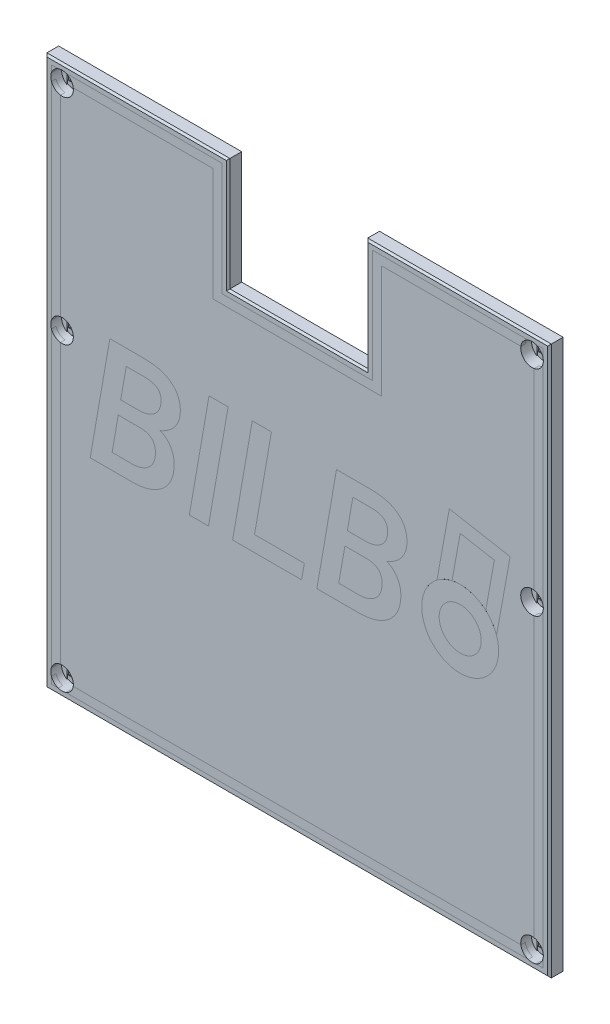
from build123d import *
from build123d.topology import SkipClean

# Parameters (mm, degrees)
SKETCH1_R             = 1.35
BOSS_EXTRUDE1_DEPTH   = 3
SKETCH3_R             = 2.5
CUT_EXTRUDE1_DEPTH    = 2.4
SKETCH4_W             = 91.5
SKETCH4_H             = 85.5
CUT_EXTRUDE2_DEPTH    = 1.5
CUT_EXTRUDE3_DEPTH    = 0.2
SKETCH6_W             = 2.7
SKETCH6_H             = 2.7
CUT_EXTRUDE4_DEPTH    = 0.2
CHAMFER1_SIZE         = 0.4
CUT_EXTRUDE5_DEPTH    = 1
BOSS_EXTRUDE2_DEPTH   = 1
SKETCH9_R             = 2.5
CUT_EXTRUDE6_DEPTH    = 2.4
CUT_EXTRUDE8_DEPTH    = 1
BOSS_EXTRUDE4_DEPTH   = 1
BOSS_EXTRUDE4_2_DEPTH = 1
BOSS_EXTRUDE4_3_DEPTH = 1
BOSS_EXTRUDE4_4_DEPTH = 1
BOSS_EXTRUDE4_5_DEPTH = 1
CUT_EXTRUDE9_DEPTH    = 1
BOSS_EXTRUDE5_DEPTH   = 1


with BuildPart() as part:
    # Sketch1 → Boss-Extrude1 (new body)
    with BuildSketch(Plane.XY):
        Polygon((-15.25, 53.75), (-15.25, 28.75), (15.25, 28.75), (15.25, 53.75), (55.875, 53.75), (55.875, -67.75), (-55.75, -67.75), (-55.75, 53.75), align=None)
        with Locations((-52, 50)):
            Circle(SKETCH1_R, mode=Mode.SUBTRACT)
        with Locations((-52, 2.6)):
            Circle(SKETCH1_R, mode=Mode.SUBTRACT)
        with Locations((-52, -64)):
            Circle(SKETCH1_R, mode=Mode.SUBTRACT)
        with Locations((52, 50)):
            Circle(SKETCH1_R, mode=Mode.SUBTRACT)
        with Locations((52, 2.6)):
            Circle(SKETCH1_R, mode=Mode.SUBTRACT)
        with Locations((52, -64)):
            Circle(SKETCH1_R, mode=Mode.SUBTRACT)
    extrude(amount=BOSS_EXTRUDE1_DEPTH)

    # Sketch3 → Cut-Extrude1 (cut)
    with BuildSketch(Plane.XY.offset(3)):
        with Locations((-52, 50)):
            Circle(SKETCH3_R)
        with Locations((-52, 2.6)):
            Circle(SKETCH3_R)
        with Locations((-52, -64)):
            Circle(SKETCH3_R)
        with Locations((52, -64)):
            Circle(SKETCH3_R)
        with Locations((52, 2.6)):
            Circle(SKETCH3_R)
        with Locations((52, 50)):
            Circle(SKETCH3_R)
    extrude(amount=-CUT_EXTRUDE1_DEPTH, mode=Mode.SUBTRACT)

    # Sketch4 → Cut-Extrude2 (cut)
    with BuildSketch(Plane(origin=(0, 0, 0), x_dir=(-1, 0, 0), z_dir=(0, 0, -1))):
        with Locations((0, -15)):
            Rectangle(SKETCH4_W, SKETCH4_H)
    extrude(amount=-CUT_EXTRUDE2_DEPTH, mode=Mode.SUBTRACT)

    # Sketch5 → Cut-Extrude3 (cut)
    with SkipClean():  # the faces are left unmerged after this step: merging them gives an invalid solid
        with BuildSketch(Plane.XY.offset(0.6)):
            with BuildLine():
                Line((-53.35, 47.895837459), (-53.35, 52.104162541))
                ThreePointArc((-53.35, 52.104162541), (-52, 52.5), (-50.65, 52.104162541))
                Line((-50.65, 52.104162541), (-50.65, 47.895837459))
                ThreePointArc((-50.65, 47.895837459), (-52, 47.5), (-53.35, 47.895837459))
            make_face()
            with BuildLine():
                Line((-53.35, 0.495837459), (-53.35, 4.704162541))
                ThreePointArc((-53.35, 4.704162541), (-52, 5.1), (-50.65, 4.704162541))
                Line((-50.65, 4.704162541), (-50.65, 0.495837459))
                ThreePointArc((-50.65, 0.495837459), (-52, 0.1), (-53.35, 0.495837459))
            make_face()
            with BuildLine():
                Line((-53.35, -66.104162541), (-53.35, -61.895837459))
                ThreePointArc((-53.35, -61.895837459), (-52, -61.5), (-50.65, -61.895837459))
                Line((-50.65, -61.895837459), (-50.65, -66.104162541))
                ThreePointArc((-50.65, -66.104162541), (-52, -66.5), (-53.35, -66.104162541))
            make_face()
        cut_extrude3 = extrude(amount=-CUT_EXTRUDE3_DEPTH, mode=Mode.SUBTRACT)

    # Sketch6 → Cut-Extrude4 (cut)
    with SkipClean():  # the faces are left unmerged after this step: merging them gives an invalid solid
        with BuildSketch(Plane.XY.offset(0.4)):
            with Locations((-52, -64)):
                Rectangle(SKETCH6_W, SKETCH6_H)
            with Locations((-52, 2.6)):
                Rectangle(SKETCH6_W, SKETCH6_H)
            with Locations((-52, 50)):
                Rectangle(SKETCH6_W, SKETCH6_H)
        cut_extrude4 = extrude(amount=-CUT_EXTRUDE4_DEPTH, mode=Mode.SUBTRACT)

    # Mirror1: Cut-Extrude3, Cut-Extrude4 across plane
    with SkipClean():  # the faces are left unmerged after this step: merging them gives an invalid solid
        add(cut_extrude3.mirror(Plane(origin=(0, 0, 0), x_dir=(0, 0, 1), z_dir=(1, 0, 0))), mode=Mode.SUBTRACT)
        add(cut_extrude4.mirror(Plane(origin=(0, 0, 0), x_dir=(0, 0, 1), z_dir=(1, 0, 0))), mode=Mode.SUBTRACT)

    # Chamfer1
    chamfer1_edges = [part.edges().sort_by_distance(p)[0] for p in [
        (55.875, -7, 3),
        (35.5625, 53.75, 3),
        (15.25, 41.25, 3),
        (0, 28.75, 3),
        (-15.25, 41.25, 3),
        (-35.5, 53.75, 3),
        (-55.75, -7, 3),
        (0.0625, -67.75, 3),
    ]]
    chamfer(chamfer1_edges, length=CHAMFER1_SIZE)

    # Sketch8 → Cut-Extrude5 (cut)
    with SkipClean():  # the faces are left unmerged after this step: merging them gives an invalid solid
        with BuildSketch(Plane.XY.offset(3)):
            Polygon((-54.35, 52.35), (-54.35, -66.35), (54.475, -66.35), (54.475, 52.35), (16.65, 52.35), (16.65, 27.35), (-16.65, 27.35), (-16.65, 52.35), align=None)
            Polygon((-52.35, 50.35), (-52.35, -64.35), (52.475, -64.35), (52.475, 50.35), (18.65, 50.35), (18.65, 25.35), (-18.65, 25.35), (-18.65, 50.35), align=None, mode=Mode.SUBTRACT)
        extrude(amount=-CUT_EXTRUDE5_DEPTH, mode=Mode.SUBTRACT)

    # Sketch12 → Cut-Extrude8 (cut)
    # profile 1 of 5: a face of its own
    with SkipClean():  # the faces are left unmerged after this step: merging them gives an invalid solid
        with BuildSketch(Plane.XY.offset(3)):
            with BuildLine():
                add(Edge.make_bspline(
                    [(44.615380572, -10.515732618), (44.615380572, -8.259142089), (43.71895185, -6.094974003), (42.123302186, -4.499322954)],
                    knots=[0, 0, 0, 0, 1, 1, 1, 1], degree=3))
                add(Edge.make_bspline(
                    [(42.123302186, -4.499322954), (40.527651137, -2.903673291), (38.363483052, -2.007244569), (36.106892522, -2.007244569)],
                    knots=[0, 0, 0, 0, 1, 1, 1, 1], degree=3))
                add(Edge.make_bspline(
                    [(36.106892522, -2.007244569), (32.665530039, -2.007244569), (29.563027687, -4.080271661), (28.246075041, -7.259674962)],
                    knots=[0, 0, 0, 0, 1, 1, 1, 1], degree=3))
                add(Edge.make_bspline(
                    [(28.246075041, -7.259674962), (26.929122395, -10.439079648), (27.657072789, -14.098730829), (30.090482858, -16.532142283)],
                    knots=[0, 0, 0, 0, 1, 1, 1, 1], degree=3))
                add(Edge.make_bspline(
                    [(30.090482858, -16.532142283), (32.523894312, -18.965552351), (36.183545492, -19.693502745), (39.362950179, -18.376550099)],
                    knots=[0, 0, 0, 0, 1, 1, 1, 1], degree=3))
                add(Edge.make_bspline(
                    [(39.362950179, -18.376550099), (42.542353479, -17.059597454), (44.615380572, -13.957095102), (44.615380572, -10.515732618)],
                    knots=[0, 0, 0, 0, 1, 1, 1, 1], degree=3))
            make_face()
            with BuildLine():
                add(Edge.make_bspline(
                    [(39.400110889, -7.222514251), (38.526694267, -6.349099014), (37.342088556, -5.858419426), (36.106892522, -5.858419426)],
                    knots=[0, 0, 0, 0, 1, 1, 1, 1], degree=3))
                add(Edge.make_bspline(
                    [(36.106892522, -5.858419426), (34.223185009, -5.858419426), (32.524959648, -6.993137187), (31.804095335, -8.733456501)],
                    knots=[0, 0, 0, 0, 1, 1, 1, 1], degree=3))
                add(Edge.make_bspline(
                    [(31.804095335, -8.733456501), (31.083232408, -10.47377443), (31.481691813, -12.476968645), (32.813674154, -13.808950986)],
                    knots=[0, 0, 0, 0, 1, 1, 1, 1], degree=3))
                add(Edge.make_bspline(
                    [(32.813674154, -13.808950986), (34.145656495, -15.140933327), (36.14885071, -15.539392733), (37.889168639, -14.818529805)],
                    knots=[0, 0, 0, 0, 1, 1, 1, 1], degree=3))
                add(Edge.make_bspline(
                    [(37.889168639, -14.818529805), (39.629487953, -14.097665492), (40.764205715, -12.399440131), (40.764205715, -10.515732618)],
                    knots=[0, 0, 0, 0, 1, 1, 1, 1], degree=3))
                add(Edge.make_bspline(
                    [(40.764205715, -10.515732618), (40.764205715, -9.280536584), (40.273526126, -8.095930873), (39.400110889, -7.222514251)],
                    knots=[0, 0, 0, 0, 1, 1, 1, 1], degree=3))
            make_face(mode=Mode.SUBTRACT)
        # profile 2 of 5: a face of its own
        with BuildSketch(Plane.XY.offset(3)):
            with BuildLine():
                add(Edge.make_bspline(
                    [(20.193882116, -16.683778873), (18.521539307, -18.012498708), (16.310838597, -18.676858625), (13.561781374, -18.676858625)],
                    knots=[0, 0, 0, 0, 1, 1, 1, 1], degree=3))
                Line((13.561781374, -18.676858625), (4.386795807, -18.676861396))
                Line((4.386795807, -18.676861396), (8.73374281, 6.339588017))
                Line((8.73374281, 6.339588017), (16.413932417, 6.322409639))
                add(Edge.make_bspline(
                    [(16.413932417, 6.322409639), (19.117171858, 6.310956925), (21.14460421, 5.721055579), (22.496228087, 4.55270283)],
                    knots=[0, 0, 0, 0, 1, 1, 1, 1], degree=3))
                add(Edge.make_bspline(
                    [(22.496228087, 4.55270283), (23.859294981, 3.395806951), (24.46064904, 1.786458916), (24.300290267, -0.275338504)],
                    knots=[0, 0, 0, 0, 1, 1, 1, 1], degree=3))
                add(Edge.make_bspline(
                    [(24.300290267, -0.275338504), (24.094112326, -2.703668483), (22.610764923, -4.530644402), (19.850245288, -5.756266261)],
                    knots=[0, 0, 0, 0, 1, 1, 1, 1], degree=3))
                add(Edge.make_bspline(
                    [(19.850245288, -5.756266261), (20.881151617, -6.122812673), (21.677235061, -6.792898255), (22.238497003, -7.766524391)],
                    knots=[0, 0, 0, 0, 1, 1, 1, 1], degree=3))
                add(Edge.make_bspline(
                    [(22.238497003, -7.766524391), (22.799768642, -8.740150527), (23.040311651, -9.902770685), (22.960127416, -11.25438625)],
                    knots=[0, 0, 0, 0, 1, 1, 1, 1], degree=3))
                add(Edge.make_bspline(
                    [(22.960127416, -11.25438625), (22.799768642, -13.545271195), (21.877685952, -15.355068736), (20.193882116, -16.683778873)],
                    knots=[0, 0, 0, 0, 1, 1, 1, 1], degree=3))
            make_face()
            with BuildLine():
                add(Edge.make_bspline(
                    [(20.022070629, -0.515880128), (20.308432806, 1.626095987), (19.225987186, 2.737175469), (16.77473377, 2.817355548)],
                    knots=[0, 0, 0, 0, 1, 1, 1, 1], degree=3))
                Line((16.77473377, 2.817355548), (12.359059401, 2.834533927))
                Line((12.359059401, 2.834533927), (11.139172903, -4.192745706))
                Line((11.139172903, -4.192745706), (15.039398956, -4.209924084))
                add(Edge.make_bspline(
                    [(15.039398956, -4.209924084), (16.436832303, -4.209924084), (17.576544262, -3.877748281), (18.458533449, -3.213398061)],
                    knots=[0, 0, 0, 0, 1, 1, 1, 1], degree=3))
                add(Edge.make_bspline(
                    [(18.458533449, -3.213398061), (19.340532334, -2.549038144), (19.861711855, -1.649865038), (20.022070629, -0.515880128)],
                    knots=[0, 0, 0, 0, 1, 1, 1, 1], degree=3))
            make_face(mode=Mode.SUBTRACT)
            with BuildLine():
                add(Edge.make_bspline(
                    [(18.235172974, -8.47095149), (17.719728814, -7.80660127), (16.866374875, -7.451515884), (15.675109772, -7.405698102)],
                    knots=[0, 0, 0, 0, 1, 1, 1, 1], degree=3))
                Line((15.675109772, -7.405698102), (10.589353977, -7.388533577))
                Line((10.589353977, -7.388533577), (9.232012748, -15.206164062))
                Line((9.232012748, -15.206164062), (13.682043873, -15.22334244))
                add(Edge.make_bspline(
                    [(13.682043873, -15.22334244), (15.022216422, -15.22334244), (16.161932538, -14.868252897), (17.10119222, -14.158075198)],
                    knots=[0, 0, 0, 0, 1, 1, 1, 1], degree=3))
                add(Edge.make_bspline(
                    [(17.10119222, -14.158075198), (18.040451903, -13.447905811), (18.595992337, -12.474279674), (18.767813522, -11.237196789)],
                    knots=[0, 0, 0, 0, 1, 1, 1, 1], degree=3))
                add(Edge.make_bspline(
                    [(18.767813522, -11.237196789), (18.928172295, -10.057392712), (18.750625446, -9.135311407), (18.235172974, -8.47095149)],
                    knots=[0, 0, 0, 0, 1, 1, 1, 1], degree=3))
            make_face(mode=Mode.SUBTRACT)
        # profile 3 of 5: a face of its own
        with BuildSketch(Plane.XY.offset(3)):
            Polygon((-5.664467136, 6.339588017), (-9.41006008, -15.206164062), (1.620550507, -15.206164062), (1.002004216, -18.676861396), (-14.255277022, -18.676861396), (-9.908330018, 6.339588017), align=None)
        # profile 4 of 5: a face of its own
        with BuildSketch(Plane.XY.offset(3)):
            Polygon((-15.251809971, 6.339588017), (-19.59876113, -18.676861396), (-23.825440093, -18.676861396), (-19.478488933, 6.339588017), align=None)
        # profile 5 of 5: a face of its own
        with BuildSketch(Plane.XY.offset(3)):
            with BuildLine():
                add(Edge.make_bspline(
                    [(-29.959280595, -16.683778873), (-31.63162479, -18.012498708), (-33.842326885, -18.676858625), (-36.591386879, -18.676858625)],
                    knots=[0, 0, 0, 0, 1, 1, 1, 1], degree=3))
                Line((-36.591386879, -18.676858625), (-45.766375217, -18.676861396))
                Line((-45.766375217, -18.676861396), (-41.419424057, 6.339588017))
                Line((-41.419424057, 6.339588017), (-33.739237221, 6.322409639))
                add(Edge.make_bspline(
                    [(-33.739237221, 6.322409639), (-31.035995009, 6.310956925), (-29.008564042, 5.721055579), (-27.656942936, 4.55270283)],
                    knots=[0, 0, 0, 0, 1, 1, 1, 1], degree=3))
                add(Edge.make_bspline(
                    [(-27.656942936, 4.55270283), (-26.293867731, 3.395806951), (-25.6925109, 1.786458916), (-25.852872445, -0.275338504)],
                    knots=[0, 0, 0, 0, 1, 1, 1, 1], degree=3))
                add(Edge.make_bspline(
                    [(-25.852872445, -0.275338504), (-26.059051771, -2.703668483), (-27.542399174, -4.530644402), (-30.302913267, -5.756266261)],
                    knots=[0, 0, 0, 0, 1, 1, 1, 1], degree=3))
                add(Edge.make_bspline(
                    [(-30.302913267, -5.756266261), (-29.27201525, -6.122812673), (-28.475933192, -6.792898255), (-27.914667094, -7.766524391)],
                    knots=[0, 0, 0, 0, 1, 1, 1, 1], degree=3))
                add(Edge.make_bspline(
                    [(-27.914667094, -7.766524391), (-27.353400996, -8.740150527), (-27.112857987, -9.902770685), (-27.193039452, -11.25438625)],
                    knots=[0, 0, 0, 0, 1, 1, 1, 1], degree=3))
                add(Edge.make_bspline(
                    [(-27.193039452, -11.25438625), (-27.353400996, -13.545271195), (-28.275480915, -15.355068736), (-29.959280595, -16.683778873)],
                    knots=[0, 0, 0, 0, 1, 1, 1, 1], degree=3))
            make_face()
            with BuildLine():
                add(Edge.make_bspline(
                    [(-30.131096238, -0.515880128), (-29.844736832, 1.626095987), (-30.927178296, 2.737175469), (-33.3784234, 2.817355548)],
                    knots=[0, 0, 0, 0, 1, 1, 1, 1], degree=3))
                Line((-33.3784234, 2.817355548), (-37.794101925, 2.834533927))
                Line((-37.794101925, 2.834533927), (-39.013996735, -4.192745706))
                Line((-39.013996735, -4.192745706), (-35.113767911, -4.209924084))
                add(Edge.make_bspline(
                    [(-35.113767911, -4.209924084), (-33.716329023, -4.209924084), (-32.576614293, -3.877748281), (-31.694625106, -3.213398061)],
                    knots=[0, 0, 0, 0, 1, 1, 1, 1], degree=3))
                add(Edge.make_bspline(
                    [(-31.694625106, -3.213398061), (-30.812634534, -2.549038144), (-30.291457783, -1.649865038), (-30.131096238, -0.515880128)],
                    knots=[0, 0, 0, 0, 1, 1, 1, 1], degree=3))
            make_face(mode=Mode.SUBTRACT)
            with BuildLine():
                add(Edge.make_bspline(
                    [(-31.917985581, -8.47095149), (-32.433435283, -7.80660127), (-33.286789221, -7.451515884), (-34.478047398, -7.405698102)],
                    knots=[0, 0, 0, 0, 1, 1, 1, 1], degree=3))
                Line((-34.478047398, -7.405698102), (-39.563808734, -7.388533577))
                Line((-39.563808734, -7.388533577), (-40.92115689, -15.206164062))
                Line((-40.92115689, -15.206164062), (-36.471116067, -15.22334244))
                add(Edge.make_bspline(
                    [(-36.471116067, -15.22334244), (-35.13094906, -15.22334244), (-33.991235715, -14.868252897), (-33.051973262, -14.158075198)],
                    knots=[0, 0, 0, 0, 1, 1, 1, 1], degree=3))
                add(Edge.make_bspline(
                    [(-33.051973262, -14.158075198), (-32.112710808, -13.447905811), (-31.55717176, -12.474279674), (-31.385354731, -11.237196789)],
                    knots=[0, 0, 0, 0, 1, 1, 1, 1], degree=3))
                add(Edge.make_bspline(
                    [(-31.385354731, -11.237196789), (-31.224993187, -10.057392712), (-31.402537265, -9.135311407), (-31.917985581, -8.47095149)],
                    knots=[0, 0, 0, 0, 1, 1, 1, 1], degree=3))
            make_face(mode=Mode.SUBTRACT)
        extrude(amount=-CUT_EXTRUDE8_DEPTH, mode=Mode.SUBTRACT)

    # Sketch13 → Cut-Extrude9 (cut)
    with SkipClean():  # the faces are left unmerged after this step: merging them gives an invalid solid
        with BuildSketch(Plane.XY.offset(3)):
            with BuildLine():
                Line((47.153839193, 8.834003493), (44.150600683, -7.742068053))
                add(Edge.make_bspline(
                    [(44.150600683, -7.742068053), (43.733524533, -6.532616724), (43.04508545, -5.421107018), (42.123302186, -4.499322954)],
                    knots=[0.422314757, 0.422314757, 0.422314757, 0.422314757, 1, 1, 1, 1], degree=3))
                add(Edge.make_bspline(
                    [(42.123302186, -4.499322954), (42.002886818, -4.378907691), (41.879233788, -4.262474438), (41.752547705, -4.150107948)],
                    knots=[0, 0, 0, 0, 0.075464725, 0.075464725, 0.075464725, 0.075464725], degree=3))
                Line((41.752547705, -4.150107948), (43.667067849, 6.416892568))
                Line((43.667067849, 6.416892568), (36.10931371, 7.786200181))
                Line((36.10931371, 7.786200181), (34.299851439, -2.200944127))
                add(Edge.make_bspline(
                    [(34.299851439, -2.200944127), (33.084090416, -2.465038036), (31.950776233, -2.991174154), (30.974005715, -3.729842373)],
                    knots=[0.17898971, 0.17898971, 0.17898971, 0.17898971, 0.550360789, 0.550360789, 0.550360789, 0.550360789], degree=3))
                Line((30.974005715, -3.729842373), (33.692202729, 11.272971598))
                Line((33.692202729, 11.272971598), (47.153839193, 8.834003493))
            make_face()
        extrude(amount=-CUT_EXTRUDE9_DEPTH, mode=Mode.SUBTRACT)


with BuildPart() as body_2:
    # Sketch8<2> → Boss-Extrude2 (new body)
    with BuildSketch(Plane.XY.offset(3)):
        Polygon((-54.35, 52.35), (-54.35, -66.35), (54.475, -66.35), (54.475, 52.35), (16.65, 52.35), (16.65, 27.35), (-16.65, 27.35), (-16.65, 52.35), align=None)
        Polygon((-52.35, 50.35), (-52.35, -64.35), (52.475, -64.35), (52.475, 50.35), (18.65, 50.35), (18.65, 25.35), (-18.65, 25.35), (-18.65, 50.35), align=None, mode=Mode.SUBTRACT)
    extrude(amount=-BOSS_EXTRUDE2_DEPTH)

    # Sketch9 → Cut-Extrude6 (cut)
    with BuildSketch(Plane.XY.offset(3)):
        with Locations(Location((-52, 2.6, 0), (0, 0, 57.316361154))):
            Circle(SKETCH9_R)
        with Locations(Location((-52, 50, 0), (0, 0, 8.047846247))):
            Circle(SKETCH9_R)
        with Locations(Location((52, 50, 0), (0, 0, 8.109614456))):
            Circle(SKETCH9_R)
        with Locations(Location((52, 2.6, 0), (0, 0, 8.109614456))):
            Circle(SKETCH9_R)
        with Locations(Location((52, -64, 0), (0, 0, 8.109614456))):
            Circle(SKETCH9_R)
        with Locations(Location((-52, -64, 0), (0, 0, 351.952153753))):
            Circle(SKETCH9_R)
    extrude(amount=-CUT_EXTRUDE6_DEPTH, mode=Mode.SUBTRACT)


with BuildPart() as cut_extrude6_piece_1:
    # of the separate pieces the step leaves, piece 1, a body of its own (cut_extrude6_pieces)
    add(body_2.part.solids().sort_by_distance((-16.65, 52.35, 3))[0])


with BuildPart() as cut_extrude6_piece_2:
    # of the separate pieces the step leaves, piece 2, a body of its own (cut_extrude6_pieces)
    add(body_2.part.solids().sort_by_distance((-51.147063895, -66.35, 3))[0])


with BuildPart() as cut_extrude6_piece_3:
    # of the separate pieces the step leaves, piece 3, a body of its own (cut_extrude6_pieces)
    add(body_2.part.solids().sort_by_distance((52.475, -61.545539774, 3))[0])


with BuildPart() as cut_extrude6_piece_4:
    # of the separate pieces the step leaves, piece 4, a body of its own (cut_extrude6_pieces)
    add(body_2.part.solids().sort_by_distance((-54.35, 1.747063895, 3))[0])


with BuildPart() as cut_extrude6_piece_5:
    # of the separate pieces the step leaves, piece 5, a body of its own (cut_extrude6_pieces)
    add(body_2.part.solids().sort_by_distance((54.475, 2.952668399, 3))[0])


with BuildPart() as cut_extrude6_piece_6:
    # of the separate pieces the step leaves, piece 6, a body of its own (cut_extrude6_pieces)
    add(body_2.part.solids().sort_by_distance((-54.35, 49.147063895, 3))[0])


with BuildPart() as cut_extrude6_piece_7:
    # of the separate pieces the step leaves, piece 7, a body of its own (cut_extrude6_pieces)
    add(body_2.part.solids().sort_by_distance((52.852936105, -66.35, 3))[0])


with BuildPart() as cut_extrude6_piece_8:
    # of the separate pieces the step leaves, piece 8, a body of its own (cut_extrude6_pieces)
    add(body_2.part.solids().sort_by_distance((54.475, 52.35, 3))[0])


with BuildPart() as cut_extrude6_piece_9:
    # of the separate pieces the step leaves, piece 9, a body of its own (cut_extrude6_pieces)
    add(body_2.part.solids().sort_by_distance((-54.35, -64.852936105, 3))[0])


with BuildPart() as cut_extrude6_piece_10:
    # of the separate pieces the step leaves, piece 10, a body of its own (cut_extrude6_pieces)
    add(body_2.part.solids().sort_by_distance((-54.35, 52.35, 3))[0])


with BuildPart() as body_12:
    # Sketch12<3> → Boss-Extrude4 (new body)
    with BuildSketch(Plane.XY.offset(3)):
        with BuildLine():
            add(Edge.make_bspline(
                [(-29.959280595, -16.683778873), (-31.63162479, -18.012498708), (-33.842326885, -18.676858625), (-36.591386879, -18.676858625)],
                knots=[0, 0, 0, 0, 1, 1, 1, 1], degree=3))
            Line((-36.591386879, -18.676858625), (-45.766375217, -18.676861396))
            Line((-45.766375217, -18.676861396), (-41.419424057, 6.339588017))
            Line((-41.419424057, 6.339588017), (-33.739237221, 6.322409639))
            add(Edge.make_bspline(
                [(-33.739237221, 6.322409639), (-31.035995009, 6.310956925), (-29.008564042, 5.721055579), (-27.656942936, 4.55270283)],
                knots=[0, 0, 0, 0, 1, 1, 1, 1], degree=3))
            add(Edge.make_bspline(
                [(-27.656942936, 4.55270283), (-26.293867731, 3.395806951), (-25.6925109, 1.786458916), (-25.852872445, -0.275338504)],
                knots=[0, 0, 0, 0, 1, 1, 1, 1], degree=3))
            add(Edge.make_bspline(
                [(-25.852872445, -0.275338504), (-26.059051771, -2.703668483), (-27.542399174, -4.530644402), (-30.302913267, -5.756266261)],
                knots=[0, 0, 0, 0, 1, 1, 1, 1], degree=3))
            add(Edge.make_bspline(
                [(-30.302913267, -5.756266261), (-29.27201525, -6.122812673), (-28.475933192, -6.792898255), (-27.914667094, -7.766524391)],
                knots=[0, 0, 0, 0, 1, 1, 1, 1], degree=3))
            add(Edge.make_bspline(
                [(-27.914667094, -7.766524391), (-27.353400996, -8.740150527), (-27.112857987, -9.902770685), (-27.193039452, -11.25438625)],
                knots=[0, 0, 0, 0, 1, 1, 1, 1], degree=3))
            add(Edge.make_bspline(
                [(-27.193039452, -11.25438625), (-27.353400996, -13.545271195), (-28.275480915, -15.355068736), (-29.959280595, -16.683778873)],
                knots=[0, 0, 0, 0, 1, 1, 1, 1], degree=3))
        make_face()
        with BuildLine():
            add(Edge.make_bspline(
                [(-30.131096238, -0.515880128), (-29.844736832, 1.626095987), (-30.927178296, 2.737175469), (-33.3784234, 2.817355548)],
                knots=[0, 0, 0, 0, 1, 1, 1, 1], degree=3))
            Line((-33.3784234, 2.817355548), (-37.794101925, 2.834533927))
            Line((-37.794101925, 2.834533927), (-39.013996735, -4.192745706))
            Line((-39.013996735, -4.192745706), (-35.113767911, -4.209924084))
            add(Edge.make_bspline(
                [(-35.113767911, -4.209924084), (-33.716329023, -4.209924084), (-32.576614293, -3.877748281), (-31.694625106, -3.213398061)],
                knots=[0, 0, 0, 0, 1, 1, 1, 1], degree=3))
            add(Edge.make_bspline(
                [(-31.694625106, -3.213398061), (-30.812634534, -2.549038144), (-30.291457783, -1.649865038), (-30.131096238, -0.515880128)],
                knots=[0, 0, 0, 0, 1, 1, 1, 1], degree=3))
        make_face(mode=Mode.SUBTRACT)
        with BuildLine():
            add(Edge.make_bspline(
                [(-31.917985581, -8.47095149), (-32.433435283, -7.80660127), (-33.286789221, -7.451515884), (-34.478047398, -7.405698102)],
                knots=[0, 0, 0, 0, 1, 1, 1, 1], degree=3))
            Line((-34.478047398, -7.405698102), (-39.563808734, -7.388533577))
            Line((-39.563808734, -7.388533577), (-40.92115689, -15.206164062))
            Line((-40.92115689, -15.206164062), (-36.471116067, -15.22334244))
            add(Edge.make_bspline(
                [(-36.471116067, -15.22334244), (-35.13094906, -15.22334244), (-33.991235715, -14.868252897), (-33.051973262, -14.158075198)],
                knots=[0, 0, 0, 0, 1, 1, 1, 1], degree=3))
            add(Edge.make_bspline(
                [(-33.051973262, -14.158075198), (-32.112710808, -13.447905811), (-31.55717176, -12.474279674), (-31.385354731, -11.237196789)],
                knots=[0, 0, 0, 0, 1, 1, 1, 1], degree=3))
            add(Edge.make_bspline(
                [(-31.385354731, -11.237196789), (-31.224993187, -10.057392712), (-31.402537265, -9.135311407), (-31.917985581, -8.47095149)],
                knots=[0, 0, 0, 0, 1, 1, 1, 1], degree=3))
        make_face(mode=Mode.SUBTRACT)
    extrude(amount=-BOSS_EXTRUDE4_DEPTH)


with BuildPart() as body_13:
    # Sketch12<3> → Boss-Extrude4 2 (new body)
    with BuildSketch(Plane.XY.offset(3)):
        Polygon((-15.251809971, 6.339588017), (-19.59876113, -18.676861396), (-23.825440093, -18.676861396), (-19.478488933, 6.339588017), align=None)
    extrude(amount=-BOSS_EXTRUDE4_2_DEPTH)


with BuildPart() as body_14:
    # Sketch12<3> → Boss-Extrude4 3 (new body)
    with BuildSketch(Plane.XY.offset(3)):
        Polygon((-5.664467136, 6.339588017), (-9.41006008, -15.206164062), (1.620550507, -15.206164062), (1.002004216, -18.676861396), (-14.255277022, -18.676861396), (-9.908330018, 6.339588017), align=None)
    extrude(amount=-BOSS_EXTRUDE4_3_DEPTH)


with BuildPart() as body_15:
    # Sketch12<3> → Boss-Extrude4 4 (new body)
    with BuildSketch(Plane.XY.offset(3)):
        with BuildLine():
            add(Edge.make_bspline(
                [(20.193882116, -16.683778873), (18.521539307, -18.012498708), (16.310838597, -18.676858625), (13.561781374, -18.676858625)],
                knots=[0, 0, 0, 0, 1, 1, 1, 1], degree=3))
            Line((13.561781374, -18.676858625), (4.386795807, -18.676861396))
            Line((4.386795807, -18.676861396), (8.73374281, 6.339588017))
            Line((8.73374281, 6.339588017), (16.413932417, 6.322409639))
            add(Edge.make_bspline(
                [(16.413932417, 6.322409639), (19.117171858, 6.310956925), (21.14460421, 5.721055579), (22.496228087, 4.55270283)],
                knots=[0, 0, 0, 0, 1, 1, 1, 1], degree=3))
            add(Edge.make_bspline(
                [(22.496228087, 4.55270283), (23.859294981, 3.395806951), (24.46064904, 1.786458916), (24.300290267, -0.275338504)],
                knots=[0, 0, 0, 0, 1, 1, 1, 1], degree=3))
            add(Edge.make_bspline(
                [(24.300290267, -0.275338504), (24.094112326, -2.703668483), (22.610764923, -4.530644402), (19.850245288, -5.756266261)],
                knots=[0, 0, 0, 0, 1, 1, 1, 1], degree=3))
            add(Edge.make_bspline(
                [(19.850245288, -5.756266261), (20.881151617, -6.122812673), (21.677235061, -6.792898255), (22.238497003, -7.766524391)],
                knots=[0, 0, 0, 0, 1, 1, 1, 1], degree=3))
            add(Edge.make_bspline(
                [(22.238497003, -7.766524391), (22.799768642, -8.740150527), (23.040311651, -9.902770685), (22.960127416, -11.25438625)],
                knots=[0, 0, 0, 0, 1, 1, 1, 1], degree=3))
            add(Edge.make_bspline(
                [(22.960127416, -11.25438625), (22.799768642, -13.545271195), (21.877685952, -15.355068736), (20.193882116, -16.683778873)],
                knots=[0, 0, 0, 0, 1, 1, 1, 1], degree=3))
        make_face()
        with BuildLine():
            add(Edge.make_bspline(
                [(20.022070629, -0.515880128), (20.308432806, 1.626095987), (19.225987186, 2.737175469), (16.77473377, 2.817355548)],
                knots=[0, 0, 0, 0, 1, 1, 1, 1], degree=3))
            Line((16.77473377, 2.817355548), (12.359059401, 2.834533927))
            Line((12.359059401, 2.834533927), (11.139172903, -4.192745706))
            Line((11.139172903, -4.192745706), (15.039398956, -4.209924084))
            add(Edge.make_bspline(
                [(15.039398956, -4.209924084), (16.436832303, -4.209924084), (17.576544262, -3.877748281), (18.458533449, -3.213398061)],
                knots=[0, 0, 0, 0, 1, 1, 1, 1], degree=3))
            add(Edge.make_bspline(
                [(18.458533449, -3.213398061), (19.340532334, -2.549038144), (19.861711855, -1.649865038), (20.022070629, -0.515880128)],
                knots=[0, 0, 0, 0, 1, 1, 1, 1], degree=3))
        make_face(mode=Mode.SUBTRACT)
        with BuildLine():
            add(Edge.make_bspline(
                [(18.235172974, -8.47095149), (17.719728814, -7.80660127), (16.866374875, -7.451515884), (15.675109772, -7.405698102)],
                knots=[0, 0, 0, 0, 1, 1, 1, 1], degree=3))
            Line((15.675109772, -7.405698102), (10.589353977, -7.388533577))
            Line((10.589353977, -7.388533577), (9.232012748, -15.206164062))
            Line((9.232012748, -15.206164062), (13.682043873, -15.22334244))
            add(Edge.make_bspline(
                [(13.682043873, -15.22334244), (15.022216422, -15.22334244), (16.161932538, -14.868252897), (17.10119222, -14.158075198)],
                knots=[0, 0, 0, 0, 1, 1, 1, 1], degree=3))
            add(Edge.make_bspline(
                [(17.10119222, -14.158075198), (18.040451903, -13.447905811), (18.595992337, -12.474279674), (18.767813522, -11.237196789)],
                knots=[0, 0, 0, 0, 1, 1, 1, 1], degree=3))
            add(Edge.make_bspline(
                [(18.767813522, -11.237196789), (18.928172295, -10.057392712), (18.750625446, -9.135311407), (18.235172974, -8.47095149)],
                knots=[0, 0, 0, 0, 1, 1, 1, 1], degree=3))
        make_face(mode=Mode.SUBTRACT)
    extrude(amount=-BOSS_EXTRUDE4_4_DEPTH)


with BuildPart() as body_16:
    # Sketch12<3> → Boss-Extrude4 5 (new body)
    with BuildSketch(Plane.XY.offset(3)):
        with BuildLine():
            add(Edge.make_bspline(
                [(44.615380572, -10.515732618), (44.615380572, -8.259142089), (43.71895185, -6.094974003), (42.123302186, -4.499322954)],
                knots=[0, 0, 0, 0, 1, 1, 1, 1], degree=3))
            add(Edge.make_bspline(
                [(42.123302186, -4.499322954), (40.527651137, -2.903673291), (38.363483052, -2.007244569), (36.106892522, -2.007244569)],
                knots=[0, 0, 0, 0, 1, 1, 1, 1], degree=3))
            add(Edge.make_bspline(
                [(36.106892522, -2.007244569), (32.665530039, -2.007244569), (29.563027687, -4.080271661), (28.246075041, -7.259674962)],
                knots=[0, 0, 0, 0, 1, 1, 1, 1], degree=3))
            add(Edge.make_bspline(
                [(28.246075041, -7.259674962), (26.929122395, -10.439079648), (27.657072789, -14.098730829), (30.090482858, -16.532142283)],
                knots=[0, 0, 0, 0, 1, 1, 1, 1], degree=3))
            add(Edge.make_bspline(
                [(30.090482858, -16.532142283), (32.523894312, -18.965552351), (36.183545492, -19.693502745), (39.362950179, -18.376550099)],
                knots=[0, 0, 0, 0, 1, 1, 1, 1], degree=3))
            add(Edge.make_bspline(
                [(39.362950179, -18.376550099), (42.542353479, -17.059597454), (44.615380572, -13.957095102), (44.615380572, -10.515732618)],
                knots=[0, 0, 0, 0, 1, 1, 1, 1], degree=3))
        make_face()
        with BuildLine():
            add(Edge.make_bspline(
                [(39.400110889, -7.222514251), (38.526694267, -6.349099014), (37.342088556, -5.858419426), (36.106892522, -5.858419426)],
                knots=[0, 0, 0, 0, 1, 1, 1, 1], degree=3))
            add(Edge.make_bspline(
                [(36.106892522, -5.858419426), (34.223185009, -5.858419426), (32.524959648, -6.993137187), (31.804095335, -8.733456501)],
                knots=[0, 0, 0, 0, 1, 1, 1, 1], degree=3))
            add(Edge.make_bspline(
                [(31.804095335, -8.733456501), (31.083232408, -10.47377443), (31.481691813, -12.476968645), (32.813674154, -13.808950986)],
                knots=[0, 0, 0, 0, 1, 1, 1, 1], degree=3))
            add(Edge.make_bspline(
                [(32.813674154, -13.808950986), (34.145656495, -15.140933327), (36.14885071, -15.539392733), (37.889168639, -14.818529805)],
                knots=[0, 0, 0, 0, 1, 1, 1, 1], degree=3))
            add(Edge.make_bspline(
                [(37.889168639, -14.818529805), (39.629487953, -14.097665492), (40.764205715, -12.399440131), (40.764205715, -10.515732618)],
                knots=[0, 0, 0, 0, 1, 1, 1, 1], degree=3))
            add(Edge.make_bspline(
                [(40.764205715, -10.515732618), (40.764205715, -9.280536584), (40.273526126, -8.095930873), (39.400110889, -7.222514251)],
                knots=[0, 0, 0, 0, 1, 1, 1, 1], degree=3))
        make_face(mode=Mode.SUBTRACT)
    extrude(amount=-BOSS_EXTRUDE4_5_DEPTH)


with BuildPart() as body_17:
    # Sketch13<2> → Boss-Extrude5 (new body)
    with BuildSketch(Plane.XY.offset(3)):
        with BuildLine():
            Line((47.153839193, 8.834003493), (44.150600683, -7.742068053))
            add(Edge.make_bspline(
                [(44.150600683, -7.742068053), (43.733524533, -6.532616724), (43.04508545, -5.421107018), (42.123302186, -4.499322954)],
                knots=[0.422314757, 0.422314757, 0.422314757, 0.422314757, 1, 1, 1, 1], degree=3))
            add(Edge.make_bspline(
                [(42.123302186, -4.499322954), (42.002886818, -4.378907691), (41.879233788, -4.262474438), (41.752547705, -4.150107948)],
                knots=[0, 0, 0, 0, 0.075464725, 0.075464725, 0.075464725, 0.075464725], degree=3))
            Line((41.752547705, -4.150107948), (43.667067849, 6.416892568))
            Line((43.667067849, 6.416892568), (36.10931371, 7.786200181))
            Line((36.10931371, 7.786200181), (34.299851439, -2.200944127))
            add(Edge.make_bspline(
                [(34.299851439, -2.200944127), (33.084090416, -2.465038036), (31.950776233, -2.991174154), (30.974005715, -3.729842373)],
                knots=[0.17898971, 0.17898971, 0.17898971, 0.17898971, 0.550360789, 0.550360789, 0.550360789, 0.550360789], degree=3))
            Line((30.974005715, -3.729842373), (33.692202729, 11.272971598))
            Line((33.692202729, 11.272971598), (47.153839193, 8.834003493))
        make_face()
    extrude(amount=-BOSS_EXTRUDE5_DEPTH)


solid = Compound([part.part, cut_extrude6_piece_1.part, cut_extrude6_piece_2.part, cut_extrude6_piece_3.part, cut_extrude6_piece_4.part, cut_extrude6_piece_5.part, cut_extrude6_piece_6.part, cut_extrude6_piece_7.part, cut_extrude6_piece_8.part, cut_extrude6_piece_9.part, cut_extrude6_piece_10.part, body_12.part, body_13.part, body_14.part, body_15.part, body_16.part, body_17.part])
